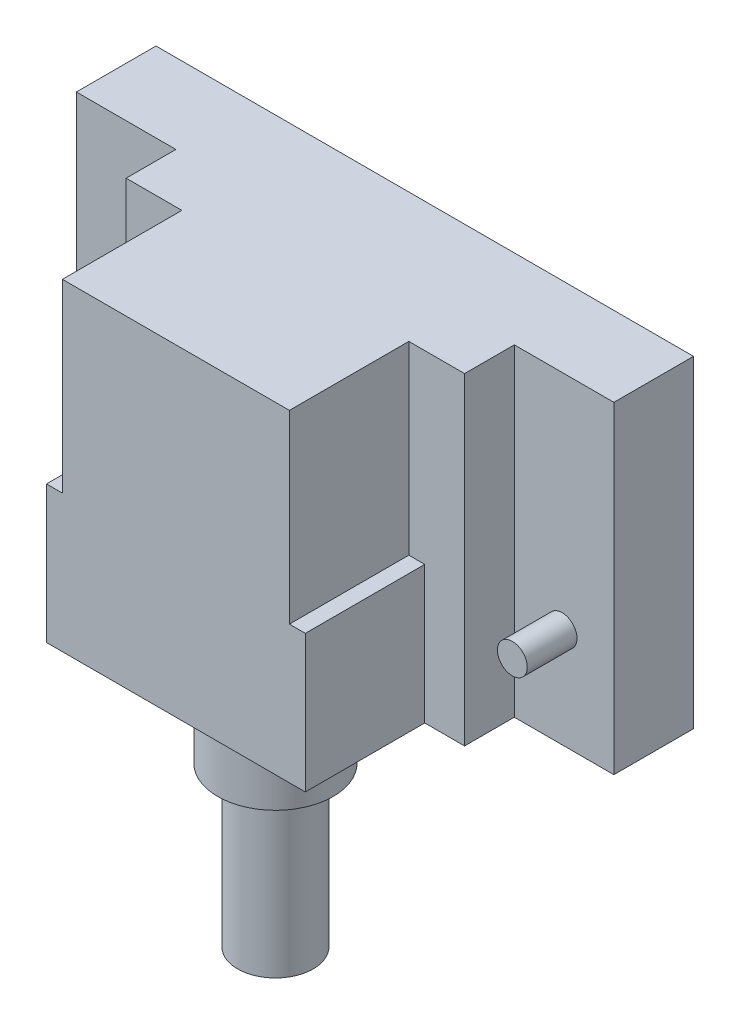
from build123d import *

# Parameters (mm, degrees)
SKETCH1_W           = 13
SKETCH1_H           = 16.2
BOSS_EXTRUDE1_DEPTH = 12.5
SKETCH2_W           = 2
SKETCH2_H           = 16.2
BOSS_EXTRUDE5_DEPTH = 6.5
SKETCH7_R           = 2.9
BOSS_EXTRUDE6_DEPTH = 2.5
SKETCH8_R           = 1.9
BOSS_EXTRUDE7_DEPTH = 8
SKETCH9_W           = 5
SKETCH9_H           = 16.2
BOSS_EXTRUDE8_DEPTH = 4
SKETCH10_W          = 0.8
SKETCH10_H          = 9.3
CUT_EXTRUDE3_DEPTH  = 6
SKETCH11_R          = 0.75
BOSS_EXTRUDE9_DEPTH = 2.5


with BuildPart() as part:
    # Sketch1 → Boss-Extrude1 (new body)
    with BuildSketch(Plane.XY):
        Rectangle(SKETCH1_W, SKETCH1_H)
    extrude(amount=-BOSS_EXTRUDE1_DEPTH)

    # Sketch2 → Boss-Extrude5 (add)
    with BuildSketch(Plane(origin=(0, 0, -12.5), x_dir=(-1, 0, 0), z_dir=(0, 0, -1))):
        with Locations((-7.5, 0)):
            Rectangle(SKETCH2_W, SKETCH2_H)
        with Locations((7.5, 0)):
            Rectangle(SKETCH2_W, SKETCH2_H)
    extrude(amount=-BOSS_EXTRUDE5_DEPTH)

    # Sketch7 → Boss-Extrude6 (add)
    with BuildSketch(Plane.XZ.offset(8.1)):
        with Locations(Location((2, -3, 0), (0, 0, 270))):
            Circle(SKETCH7_R)
    extrude(amount=BOSS_EXTRUDE6_DEPTH)

    # Sketch8 → Boss-Extrude7 (add)
    with BuildSketch(Plane.XZ.offset(10.6)):
        with Locations(Location((2, -3, 0), (0, 0, 270))):
            Circle(SKETCH8_R)
    extrude(amount=BOSS_EXTRUDE7_DEPTH)

    # Sketch9 → Boss-Extrude8 (add)
    with BuildSketch(Plane(origin=(0, 0, -12.5), x_dir=(-1, 0, 0), z_dir=(0, 0, -1))):
        with Locations((-11, 0)):
            Rectangle(SKETCH9_W, SKETCH9_H)
        with Locations((11, 0)):
            Rectangle(SKETCH9_W, SKETCH9_H)
    extrude(amount=-BOSS_EXTRUDE8_DEPTH)

    # Sketch10 → Cut-Extrude3 (cut)
    with BuildSketch(Plane.XY):
        with Locations((6.1, 3.45)):
            Rectangle(SKETCH10_W, SKETCH10_H)
        with Locations((-6.1, 3.45)):
            Rectangle(SKETCH10_W, SKETCH10_H)
    extrude(amount=-CUT_EXTRUDE3_DEPTH, mode=Mode.SUBTRACT)

    # Sketch11 → Boss-Extrude9 (add)
    with BuildSketch(Plane.XY.offset(-8.5)):
        with Locations((-10.9, -3.1)):
            Circle(SKETCH11_R)
        with Locations(Location((10.9, -3.1, 0), (0, 0, 180))):
            Circle(SKETCH11_R)
    extrude(amount=BOSS_EXTRUDE9_DEPTH)


solid = part.part
